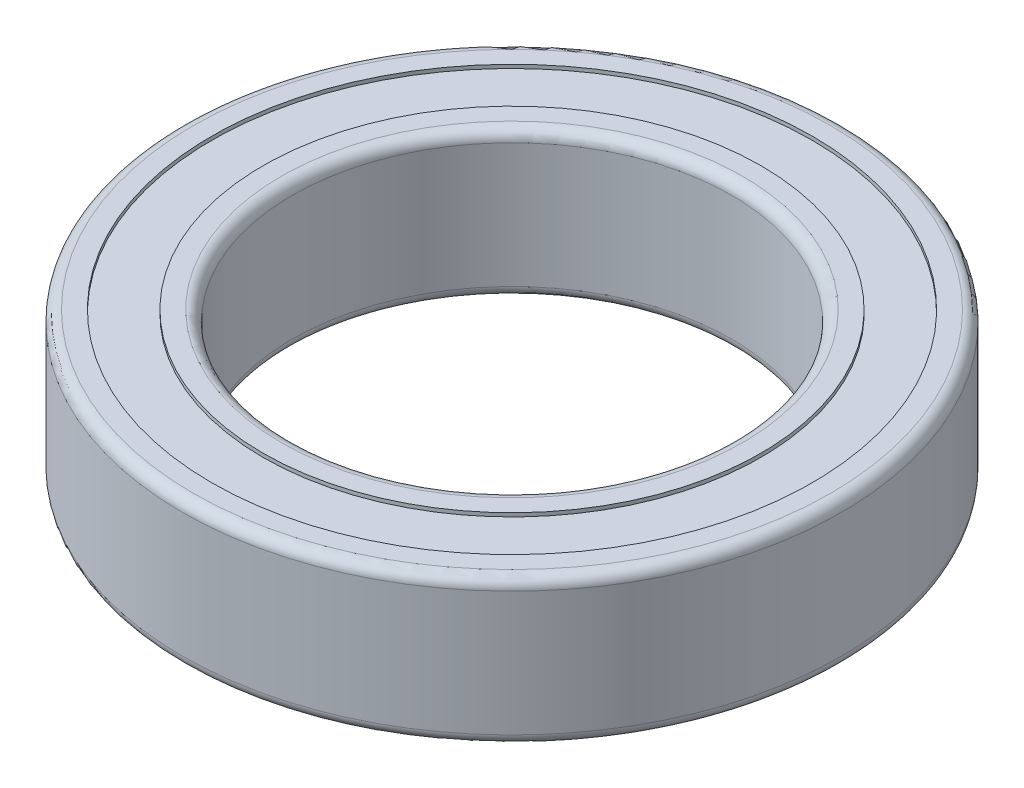
from build123d import *

# Parameters (mm, degrees)
CROQUIS1_R              = 9
CROQUIS1_R_2            = 6
SALIENTE_EXTRUIR1_DEPTH = 4
CROQUIS2_R              = 8.2
CROQUIS2_R_2            = 6.8
CORTAR_EXTRUIR1_DEPTH   = 0.1
REDONDEO1_R             = 0.3


with BuildPart() as part:
    # Croquis1 → Saliente-Extruir1 (new body)
    with BuildSketch(Plane(origin=(0, 0, 0), x_dir=(1, 0, 0), z_dir=(0, 1, 0))):
        with Locations(Location((0, 0, 0), (0, 0, 270))):
            Circle(CROQUIS1_R)
        with Locations(Location((0, 0, 0), (0, 0, 270))):
            Circle(CROQUIS1_R_2, mode=Mode.SUBTRACT)
    extrude(amount=SALIENTE_EXTRUIR1_DEPTH)

    # Croquis2 → Cortar-Extruir1 (cut)
    with BuildSketch(Plane(origin=(0, 4, 0), x_dir=(1, 0, 0), z_dir=(0, 1, 0))):
        with Locations(Location((0, 0, 0), (0, 0, 270))):
            Circle(CROQUIS2_R)
        with Locations(Location((0, 0, 0), (0, 0, 270))):
            Circle(CROQUIS2_R_2, mode=Mode.SUBTRACT)
    cortar_extruir1 = extrude(amount=-CORTAR_EXTRUIR1_DEPTH, mode=Mode.SUBTRACT)

    # Simetría1: Cortar-Extruir1 across plane
    add(cortar_extruir1.mirror(Plane.ZX.offset(2)), mode=Mode.SUBTRACT)

    # Redondeo1
    redondeo1_edges = [part.edges().sort_by_distance(p)[0] for p in [
        (0, 0, -9),
        (0, 4, -9),
        (0, 0, -6),
        (0, 4, -6),
    ]]
    fillet(redondeo1_edges, radius=REDONDEO1_R)


solid = part.part
